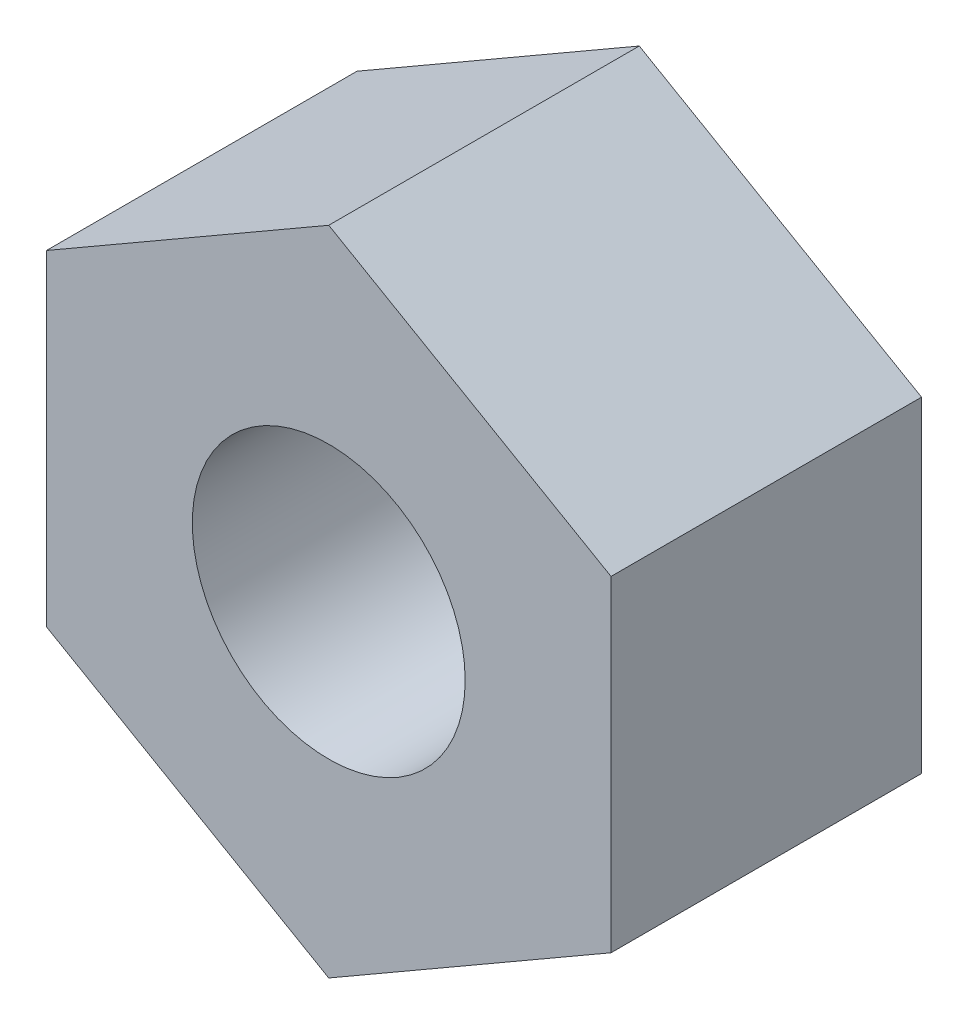
from build123d import *

# Parameters (mm, degrees)
BASENUTSKE_R  = 1.45
BASENUT_DEPTH = 3.3


with BuildPart() as part:
    # BaseNutSke → BaseNut (new body)
    with BuildSketch(Plane.XY):
        Polygon((3, 1.732050808), (3, -1.732050808), (0, -3.464101615), (-3, -1.732050808), (-3, 1.732050808), (0, 3.464101615), align=None)
        Circle(BASENUTSKE_R, mode=Mode.SUBTRACT)
    extrude(amount=-BASENUT_DEPTH)


solid = part.part
